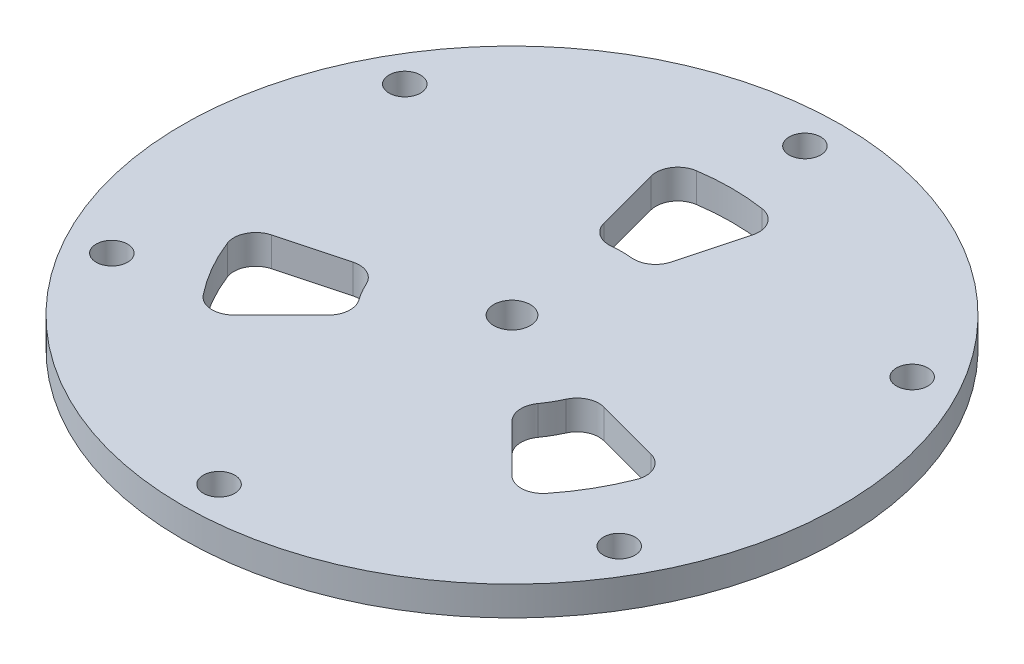
from build123d import *

# Parameters (mm, degrees)
SKETCH_1_R      = 45
SKETCH_1_R_2    = 2.15
SKETCH_1_R_3    = 2.5
EXTRUDE_1_DEPTH = 2


with BuildPart() as part:
    # Эскиз1 → Бобышка-Вытянуть1 (new, symmetric)
    with BuildSketch(Plane(origin=(0, 0, 0), x_dir=(1, 0, 0), z_dir=(0, 1, 0))):
        with Locations(Location((0, 0, 0), (0, 0, 270))):
            Circle(SKETCH_1_R)
        with Locations(Location((0, 40, 0), (0, 0, 270))):
            Circle(SKETCH_1_R_2, mode=Mode.SUBTRACT)
        with Locations(Location((0, -40, 0), (0, 0, 90))):
            Circle(SKETCH_1_R_2, mode=Mode.SUBTRACT)
        with Locations(Location((34.641016151, -20, 0), (0, 0, 270))):
            Circle(SKETCH_1_R_2, mode=Mode.SUBTRACT)
        with Locations(Location((-34.641016151, 20, 0), (0, 0, 90))):
            Circle(SKETCH_1_R_2, mode=Mode.SUBTRACT)
        with Locations(Location((-34.641016151, -20, 0), (0, 0, 270))):
            Circle(SKETCH_1_R_2, mode=Mode.SUBTRACT)
        with Locations(Location((34.641016151, 20, 0), (0, 0, 90))):
            Circle(SKETCH_1_R_2, mode=Mode.SUBTRACT)
        with Locations(Location((0, 0, 0), (0, 0, 270))):
            Circle(SKETCH_1_R_3, mode=Mode.SUBTRACT)
        with BuildLine():
            Line((-6.944843745, 25.918509706), (-4.593582361, 17.143482759))
            ThreePointArc((-4.593582361, 17.143482759), (-3.407818063, 15.456403642), (-1.413170735, 14.933283245))
            ThreePointArc((-1.413170735, 14.933283245), (0, 15), (1.413170735, 14.933283245))
            ThreePointArc((1.413170735, 14.933283245), (3.407818063, 15.456403642), (4.593582361, 17.143482759))
            Line((4.593582361, 17.143482759), (6.944843745, 25.918509706))
            ThreePointArc((6.944843745, 25.918509706), (6.557654897, 28.33720456), (4.496740295, 29.661074268))
            ThreePointArc((4.496740295, 29.661074268), (0, 30), (-4.496740295, 29.661074268))
            ThreePointArc((-4.496740295, 29.661074268), (-6.557654897, 28.33720456), (-6.944843745, 25.918509706))
        make_face(mode=Mode.SUBTRACT)
        with BuildLine():
            Line((18.973665961, -18.973665961), (12.549900398, -12.549900398))
            ThreePointArc((12.549900398, -12.549900398), (11.681729173, -10.679458835), (12.226017285, -8.690483379))
            ThreePointArc((12.226017285, -8.690483379), (12.990381057, -7.5), (13.639188019, -6.242799866))
            ThreePointArc((13.639188019, -6.242799866), (15.089547237, -4.776944806), (17.143482759, -4.593582361))
            Line((17.143482759, -4.593582361), (25.918509706, -6.944843745))
            ThreePointArc((25.918509706, -6.944843745), (27.819566469, -8.48950655), (27.935613967, -10.936245804))
            ThreePointArc((27.935613967, -10.936245804), (25.980762114, -15), (23.438873672, -18.724828464))
            ThreePointArc((23.438873672, -18.724828464), (21.261911572, -19.84769801), (18.973665961, -18.973665961))
        make_face(mode=Mode.SUBTRACT)
        with BuildLine():
            Line((-25.918509706, -6.944843745), (-17.143482759, -4.593582361))
            ThreePointArc((-17.143482759, -4.593582361), (-15.089547237, -4.776944806), (-13.639188019, -6.242799866))
            ThreePointArc((-13.639188019, -6.242799866), (-12.990381057, -7.5), (-12.226017285, -8.690483379))
            ThreePointArc((-12.226017285, -8.690483379), (-11.681729173, -10.679458835), (-12.549900398, -12.549900398))
            Line((-12.549900398, -12.549900398), (-18.973665961, -18.973665961))
            ThreePointArc((-18.973665961, -18.973665961), (-21.261911572, -19.84769801), (-23.438873672, -18.724828464))
            ThreePointArc((-23.438873672, -18.724828464), (-25.980762114, -15), (-27.935613967, -10.936245804))
            ThreePointArc((-27.935613967, -10.936245804), (-27.819566469, -8.48950655), (-25.918509706, -6.944843745))
        make_face(mode=Mode.SUBTRACT)
    extrude(amount=EXTRUDE_1_DEPTH, both=True)


solid = part.part
